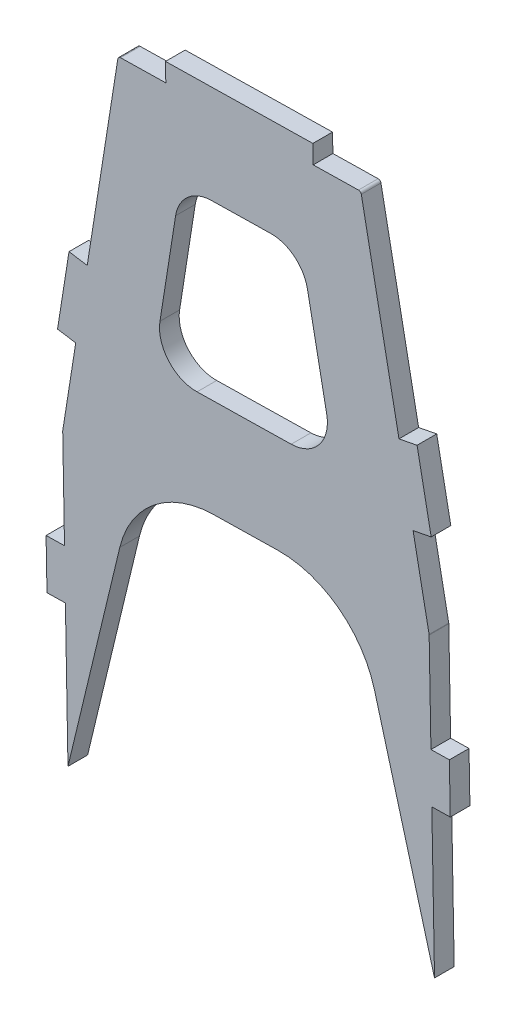
from build123d import *

# Parameters (mm, degrees)
BOSS_EXTRUDE2_DEPTH = 5.08
FILLET2_R           = 9.525
FILLET3_R           = 25.4


with BuildPart() as part:
    # Sketch5 → Boss-Extrude2 (new body)
    with BuildSketch(Plane(origin=(0, 0, -50.8), x_dir=(-1, 0, 0), z_dir=(0, 0, -1))):
        with BuildLine():
            Line((-52.084134713, -74.90469108), (-56.217901117, -96.079564574))
            ThreePointArc((-56.217901117, -96.079564574), (-56.227450796, -96.143111106), (-56.231425689, -96.207248133))
            Line((-56.231425689, -96.207248133), (-56.695270711, -121.603012501))
            Line((-56.695270711, -121.603012501), (-61.45697653, -121.516041559))
            Line((-61.45697653, -121.516041559), (-61.688899041, -134.213923743))
            Line((-61.688899041, -134.213923743), (-56.927193222, -134.300894684))
            Line((-56.927193222, -134.300894684), (-57.620624926, -172.266653317))
            Line((-57.620624926, -172.266653317), (-36.877249891, -96.432815008))
            Line((-36.877249891, -96.432815008), (19.109812826, -97.455399718))
            Line((19.109812826, -97.455399718), (37.101706355, -172.266653317))
            Line((37.101706355, -172.266653317), (37.763549432, -136.03038898))
            Line((37.763549432, -136.03038898), (42.525255251, -136.117359921))
            Line((42.525255251, -136.117359921), (42.757177762, -123.419477738))
            Line((42.757177762, -123.419477738), (37.995471943, -123.332506796))
            Line((37.995471943, -123.332506796), (38.459316965, -97.936742429))
            ThreePointArc((38.459316965, -97.936742429), (38.457686823, -97.872503028), (38.450464051, -97.808650153))
            Line((38.450464051, -97.808650153), (35.09270057, -76.496946406))
            Line((35.09270057, -76.496946406), (39.797167723, -75.755734526))
            Line((39.797167723, -75.755734526), (36.832320201, -56.937865912))
            Line((36.832320201, -56.937865912), (32.127853048, -57.679077792))
            Line((32.127853048, -57.679077792), (24.22159299, -7.498094822))
            ThreePointArc((24.22159299, -7.498094822), (23.977671585, -7.057207813), (23.507420242, -6.876258426))
            Line((23.507420242, -6.876258426), (11.818416858, -6.662762744))
            Line((11.818416858, -6.662762744), (11.905387799, -1.901056925))
            Line((11.905387799, -1.901056925), (-26.188258752, -1.205289392))
            Line((-26.188258752, -1.205289392), (-26.275229693, -5.966995211))
            Line((-26.275229693, -5.966995211), (-37.964233078, -5.753499529))
            ThreePointArc((-37.964233078, -5.753499529), (-38.44077853, -5.917155993), (-38.700637178, -6.348841631))
            Line((-38.700637178, -6.348841631), (-48.434089931, -56.20764123))
            Line((-48.434089931, -56.20764123), (-53.108352393, -55.295130035))
            Line((-53.108352393, -55.295130035), (-56.758397176, -73.992179884))
            Line((-56.758397176, -73.992179884), (-52.084134713, -74.90469108))
        make_face()
        Polygon((-31.935446416, -71.118839034), (-23.256774895, -26.66306829), (8.046213899, -27.234806762), (15.095699394, -71.977846959), align=None, mode=Mode.SUBTRACT)
    extrude(amount=BOSS_EXTRUDE2_DEPTH)

    # Fillet2
    fillet2_edges = [part.edges().sort_by_distance(p)[0] for p in [
        (31.935446416, -71.118839034, -53.34),
        (-15.095699394, -71.977846959, -53.34),
        (-8.046213899, -27.234806762, -53.34),
        (23.256774895, -26.66306829, -53.34),
    ]]
    fillet(fillet2_edges, radius=FILLET2_R)

    # Fillet3
    fillet3_edges = [part.edges().sort_by_distance(p)[0] for p in [
        (-19.109812826, -97.455399718, -53.34),
        (36.877249891, -96.432815008, -53.34),
    ]]
    fillet(fillet3_edges, radius=FILLET3_R)


solid = part.part
